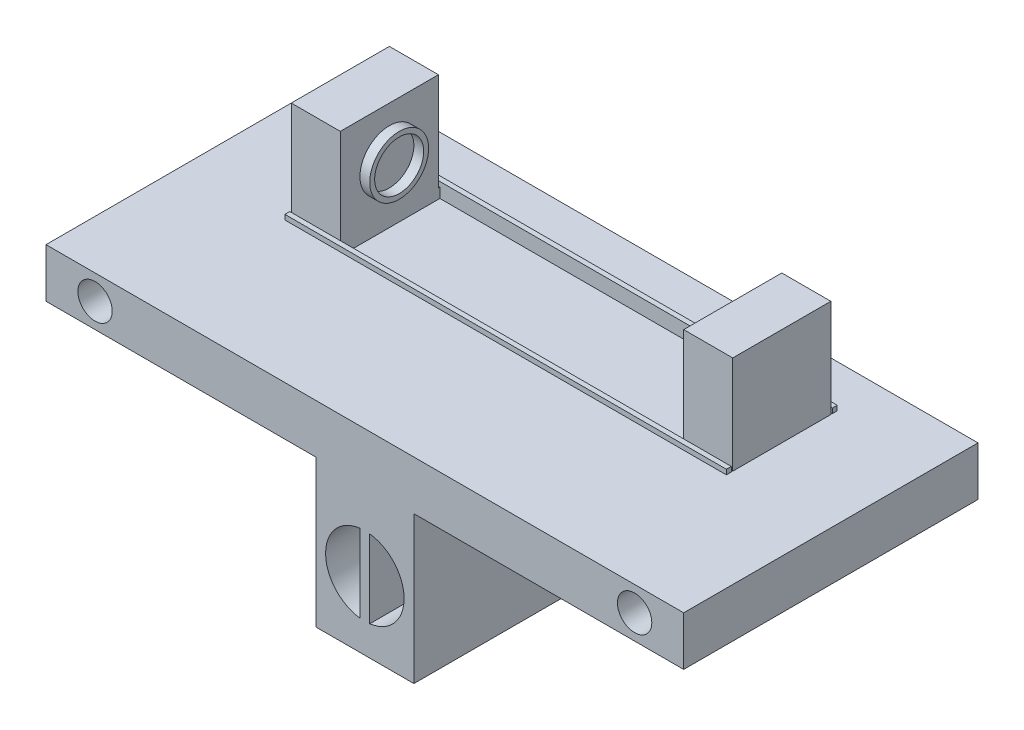
from build123d import *

# Parameters (mm, degrees)
SKETCH1_W                       = 65
SKETCH1_H                       = 30
SKETCH1_W_2                     = 5
SKETCH1_H_2                     = 10
BOSS_EXTRUDE1_DEPTH             = 5
SKETCH1_4_W                     = 5
SKETCH1_4_H                     = 10
BOSS_EXTRUDE2_DEPTH             = 15
SKETCH2_R                       = 3
SKETCH2_R_2                     = 2.5
BOSS_EXTRUDE3_DEPTH             = 1
BOSS_EXTRUDE4_START             = 1
SKETCH3_R                       = 3
SKETCH3_R_2                     = 2.5
BOSS_EXTRUDE4_DEPTH             = 1
BOSS_EXTRUDE5_REACH             = 56.314
BOSS_EXTRUDE5_DIRECTION_2_REACH = 56.314
CUT_EXTRUDE2_DEPTH              = 35
SKETCH5_R                       = 1.75
CUT_EXTRUDE3_DEPTH              = 47.703854231
SKETCH7_R                       = 1
CUT_EXTRUDE5_DEPTH              = 4.5
SKETCH10_W                      = 10
SKETCH10_H                      = 15
BOSS_EXTRUDE7_DEPTH             = 20
CUT_EXTRUDE8_DEPTH              = 10


with BuildPart() as part:
    # Sketch1 → Boss-Extrude1 (new body)
    with BuildSketch(Plane(origin=(0, 0, 0), x_dir=(1, 0, 0), z_dir=(0, 1, 0))):
        Rectangle(SKETCH1_W, SKETCH1_H)
        with Locations((20, 5)):
            Rectangle(SKETCH1_W_2, SKETCH1_H_2, mode=Mode.SUBTRACT)
        with Locations((-20, 5)):
            Rectangle(SKETCH1_W_2, SKETCH1_H_2, mode=Mode.SUBTRACT)
    extrude(amount=BOSS_EXTRUDE1_DEPTH)

    # Sketch1<4> → Boss-Extrude2 (add)
    with BuildSketch(Plane(origin=(0, 0, 0), x_dir=(1, 0, 0), z_dir=(0, 1, 0))):
        with Locations((20, 5)):
            Rectangle(SKETCH1_4_W, SKETCH1_4_H)
        with Locations((-20, 5)):
            Rectangle(SKETCH1_4_W, SKETCH1_4_H)
    extrude(amount=BOSS_EXTRUDE2_DEPTH)

    # Sketch2 → Boss-Extrude3 (add)
    with BuildSketch(Plane(origin=(-17.5, 0, 0), x_dir=(0, 0, -1), z_dir=(1, 0, 0))):
        with Locations((5, 10)):
            Circle(SKETCH2_R)
        with Locations((5, 10)):
            Circle(SKETCH2_R_2, mode=Mode.SUBTRACT)
    extrude(amount=BOSS_EXTRUDE3_DEPTH)

    # Sketch3 → Boss-Extrude4 (add)
    with BuildSketch(Plane.ZY.offset(-17.5).offset(BOSS_EXTRUDE4_START)):
        with Locations(Location((-5, 10, 0), (0, 0, 180))):
            Circle(SKETCH3_R)
        with Locations(Location((-5, 10, 0), (0, 0, 180))):
            Circle(SKETCH3_R_2, mode=Mode.SUBTRACT)
    extrude(amount=-BOSS_EXTRUDE4_DEPTH)

    # Boss-Extrude5: up to this face of the body (flat: up to its plane)
    boss_extrude5_end = Plane(part.part.faces().sort_by_distance((22.5, 10, -5))[0])
    # Sketch4 → Boss-Extrude5 (add, up to the picked face)
    with BuildSketch(Plane(origin=(-17.5, 0, 0), x_dir=(0, 0, -1), z_dir=(1, 0, 0)), mode=Mode.PRIVATE) as boss_extrude5_sk1:
        Polygon((10.15, 5.5), (10.65, 5.5), (10.65, 3.5), (-0.65, 3.5), (-0.65, 5.5), (-0.15, 5.5), (-0.15, 4), (10.15, 4), align=None)
    boss_extrude5_tool1 = split(extrude(boss_extrude5_sk1.sketch, amount=BOSS_EXTRUDE5_REACH, mode=Mode.PRIVATE), bisect_by=boss_extrude5_end, keep=Keep.BOTH, mode=Mode.PRIVATE)
    add(boss_extrude5_tool1.solids().sort_by(Axis((-17.5, 3.95979, -5), (1, 0, 0)))[0])

    # Boss-Extrude5 direction 2: up to this face of the body (flat: up to its plane)
    boss_extrude5_direction_2_end = Plane(part.part.faces().sort_by_distance((-22.5, 10, -5))[0])
    # Sketch4 → Boss-Extrude5 direction 2 (add, up to the picked face)
    with BuildSketch(Plane(origin=(-17.5, 0, 0), x_dir=(0, 0, -1), z_dir=(1, 0, 0)), mode=Mode.PRIVATE) as boss_extrude5_direction_2_sk1:
        Polygon((10.15, 5.5), (10.65, 5.5), (10.65, 3.5), (-0.65, 3.5), (-0.65, 5.5), (-0.15, 5.5), (-0.15, 4), (10.15, 4), align=None)
    boss_extrude5_direction_2_tool1 = split(extrude(boss_extrude5_direction_2_sk1.sketch, amount=-BOSS_EXTRUDE5_DIRECTION_2_REACH, mode=Mode.PRIVATE), bisect_by=boss_extrude5_direction_2_end, keep=Keep.BOTH, mode=Mode.PRIVATE)
    add(boss_extrude5_direction_2_tool1.solids().sort_by(Axis((-17.5, 3.95979, -5), (-1, 0, 0)))[0])

    # Sketch4<5> → Cut-Extrude2 (cut)
    with BuildSketch(Plane(origin=(-17.5, 0, 0), x_dir=(0, 0, -1), z_dir=(1, 0, 0))):
        Polygon((0, 5.5), (-0.15, 5.5), (-0.15, 4), (10.15, 4), (10.15, 5.5), (10, 5.5), (10, 5), (0, 5), align=None)
    extrude(amount=CUT_EXTRUDE2_DEPTH, mode=Mode.SUBTRACT)

    # Sketch5 → Cut-Extrude3 (cut, through all)
    with BuildSketch(Plane.XY.offset(15)):
        with Locations((-27.5, 2.5)):
            Circle(SKETCH5_R)
    cut_extrude3 = extrude(amount=-CUT_EXTRUDE3_DEPTH, mode=Mode.SUBTRACT)

    # Mirror1: Cut-Extrude3 across plane
    add(cut_extrude3.mirror(Plane(origin=(0, 0, 0), x_dir=(0, 0, 1), z_dir=(1, 0, 0))), mode=Mode.SUBTRACT)

    # Sketch7 → Cut-Extrude5 (cut)
    with BuildSketch(Plane(origin=(0, 5, 0), x_dir=(1, 0, 0), z_dir=(0, 1, 0))):
        with Locations(Location((0, -10, 0), (0, 0, 270))):
            Circle(SKETCH7_R)
        with Locations(Location((0, -5, 0), (0, 0, 270))):
            Circle(SKETCH7_R)
    extrude(amount=-CUT_EXTRUDE5_DEPTH, mode=Mode.SUBTRACT)

    # Sketch10 → Boss-Extrude7 (add)
    with BuildSketch(Plane(origin=(0, 5, 0), x_dir=(1, 0, 0), z_dir=(0, 1, 0))):
        with Locations((0, -7.5)):
            Rectangle(SKETCH10_W, SKETCH10_H)
    extrude(amount=-BOSS_EXTRUDE7_DEPTH)

    # Sketch11 → Cut-Extrude8 (cut)
    with BuildSketch(Plane.XY.offset(15)):
        with BuildLine():
            ThreePointArc((-0.5, -4.031373033), (-4, -8), (-0.5, -11.968626967))
            Line((-0.5, -11.968626967), (-0.5, -4.031373033))
        make_face()
        with BuildLine():
            Line((0.5, -4.031373033), (0.5, -11.968626967))
            ThreePointArc((0.5, -11.968626967), (3, -10.645751311), (4, -8))
            ThreePointArc((4, -8), (3, -5.354248689), (0.5, -4.031373033))
        make_face()
    extrude(amount=-CUT_EXTRUDE8_DEPTH, mode=Mode.SUBTRACT)


solid = part.part
